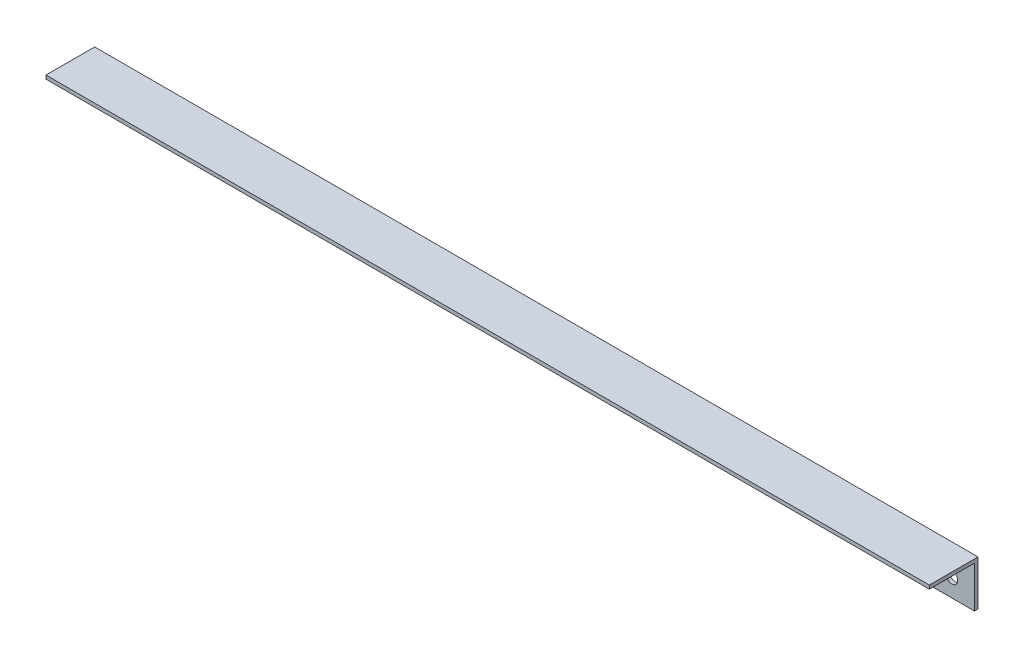
from build123d import *

# Parameters (mm, degrees)
SKETCH_1_W        = 1960
SKETCH_1_H        = 100
SKETCH_1_R        = 13
EXTRUDE_764_DEPTH = 8
SKETCH_2_W        = 1960
SKETCH_2_H        = 8
EXTRUDE_1_DEPTH   = 100


with BuildPart() as part:
    # 草图1 → Extrude 764 (new body)
    with BuildSketch(Plane.XY):
        with Locations((0, 44.512115183)):
            Rectangle(SKETCH_1_W, SKETCH_1_H)
        with Locations((930, 34.512115183)):
            Circle(SKETCH_1_R, mode=Mode.SUBTRACT)
        with Locations((850, 34.512115183)):
            Circle(SKETCH_1_R, mode=Mode.SUBTRACT)
        with Locations((770, 34.512115183)):
            Circle(SKETCH_1_R, mode=Mode.SUBTRACT)
        with Locations((330, 34.512115183)):
            Circle(SKETCH_1_R, mode=Mode.SUBTRACT)
        with Locations((250, 34.512115183)):
            Circle(SKETCH_1_R, mode=Mode.SUBTRACT)
        with Locations(Location((-770, 34.512115183, 0), (0, 0, 180))):
            Circle(SKETCH_1_R, mode=Mode.SUBTRACT)
        with Locations(Location((-850, 34.512115183, 0), (0, 0, 180))):
            Circle(SKETCH_1_R, mode=Mode.SUBTRACT)
        with Locations((170, 34.512115183)):
            Circle(SKETCH_1_R, mode=Mode.SUBTRACT)
        with Locations(Location((-170, 34.512115183, 0), (0, 0, 180))):
            Circle(SKETCH_1_R, mode=Mode.SUBTRACT)
        with Locations(Location((-250, 34.512115183, 0), (0, 0, 180))):
            Circle(SKETCH_1_R, mode=Mode.SUBTRACT)
        with Locations(Location((-330, 34.512115183, 0), (0, 0, 180))):
            Circle(SKETCH_1_R, mode=Mode.SUBTRACT)
        with Locations(Location((-930, 34.512115183, 0), (0, 0, 180))):
            Circle(SKETCH_1_R, mode=Mode.SUBTRACT)
    extrude(amount=EXTRUDE_764_DEPTH)

    # 草图2 → 凸台-拉伸1 (add)
    with BuildSketch(Plane.XY.offset(8)):
        with Locations((0, 90.512115183)):
            Rectangle(SKETCH_2_W, SKETCH_2_H)
    extrude(amount=EXTRUDE_1_DEPTH)


solid = part.part
